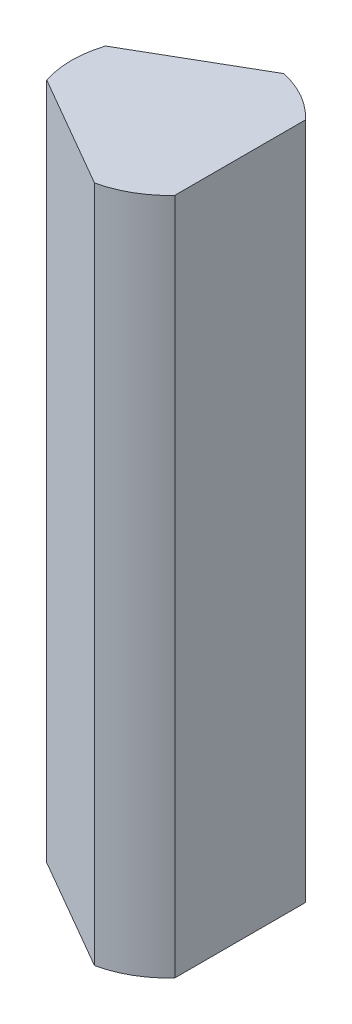
from build123d import *

# Parameters (mm, degrees)
RESSALTO_EXTRUS_O1_DEPTH = 16.0875


with BuildPart() as part:
    # Esboço1 → Ressalto-extrusão1 (new body)
    with BuildSketch(Plane(origin=(0, 0, 0), x_dir=(1, 0, 0), z_dir=(0, 1, 0))):
        with BuildLine():
            Line((0.491640786, -2.246839856), (-2.191640786, -0.697646517))
            ThreePointArc((-2.191640786, -0.697646517), (-2.3, 0), (-2.191640786, 0.697646517))
            Line((-2.191640786, 0.697646517), (0.491640786, 2.246839856))
            ThreePointArc((0.491640786, 2.246839856), (1.15, 1.991858429), (1.7, 1.549193338))
            Line((1.7, 1.549193338), (1.7, -1.549193338))
            ThreePointArc((1.7, -1.549193338), (1.15, -1.991858429), (0.491640786, -2.246839856))
        make_face()
    extrude(amount=RESSALTO_EXTRUS_O1_DEPTH)


solid = part.part
